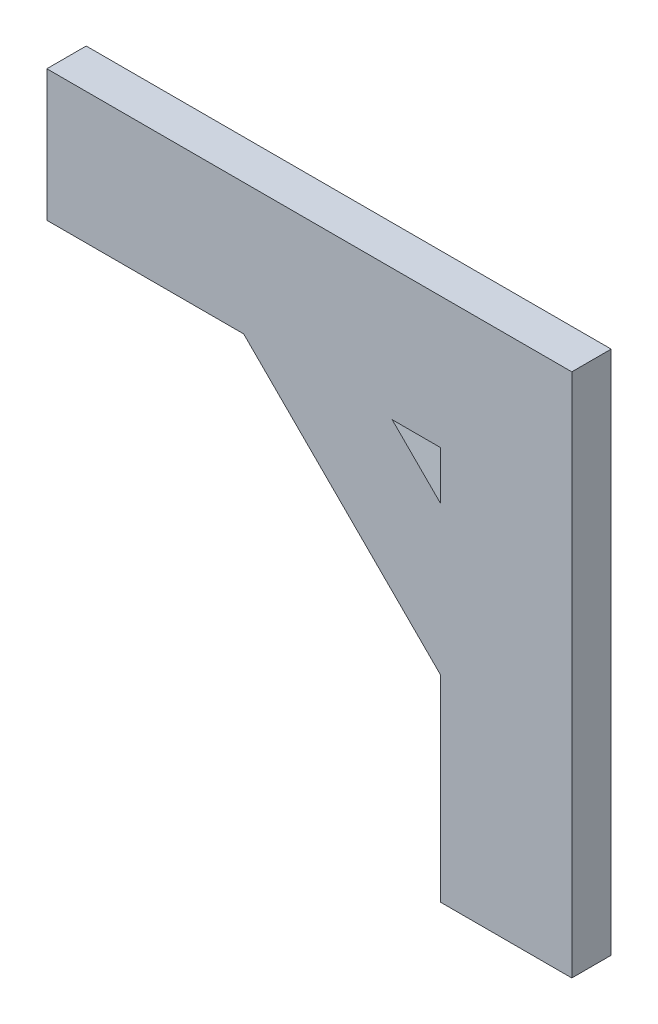
from build123d import *

# Parameters (mm, degrees)
EXTRUDE_1_DEPTH = 3


with BuildPart() as part:
    # 草圖1 → 填料-伸長1 (new body)
    with BuildSketch(Plane.XY):
        Polygon((0, -10), (30, -10), (30, -40), (40, -40), (40, -10), (40, 0), (0, 0), align=None)
        Polygon((30, -13.686291501), (26.313708499, -10), (15, -10), (30, -25), align=None)
    extrude(amount=EXTRUDE_1_DEPTH)


solid = part.part
